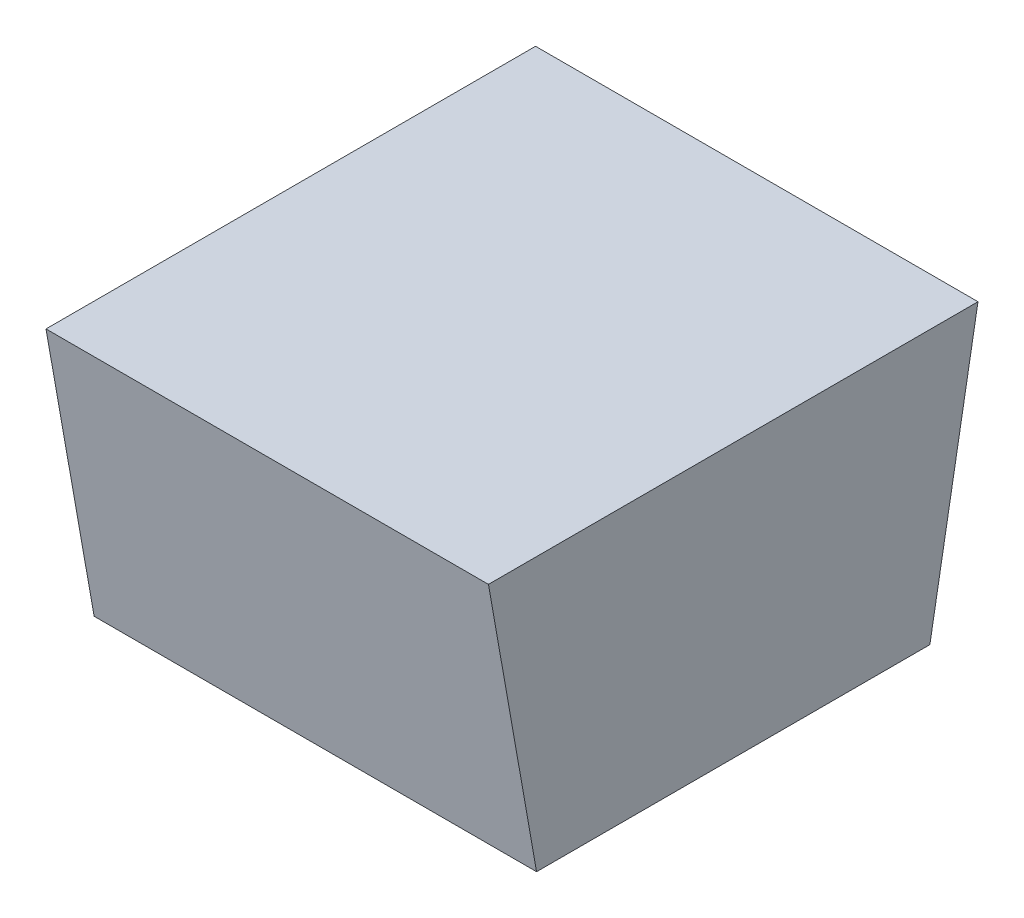
from build123d import *

# Parameters (mm, degrees)
SKETCH_TL_CUTTING_R    = 0.997000038
TL_CUTTING_DEPTH       = 29.999999944
SKETCH_TDF_CUTTING_W   = 2.014000036
SKETCH_TDF_CUTTING_H   = 2.014000036
TDF_CUTTING_DEPTH      = 31.033115303
VW_VR_GRINDING_DEPTH   = 1.007000018
VW_VR_GRINDING_2_DEPTH = 1.007000018
ISA_GRINDING_DEPTH     = 1.007000018
SKETCH_PRE_FRX_BRX_W   = 0.762
SKETCH_PRE_FRX_BRX_H   = 0.990000052
SKETCH_PRE_FRX_BRX_W_2 = 0.79199994
PRE_FRX_BRX_DEPTH      = 1.007000018
FA_BA_GRINDING_DEPTH   = 1.007000018


with BuildPart() as part:
    # sketch_TL_cutting → TL_cutting (new body)
    with BuildSketch(Plane(origin=(0, 0, 0), x_dir=(1, 0, 0), z_dir=(0, 1, 0))):
        with Locations(Location((0, 0, 0), (0, 0, 270))):
            Circle(SKETCH_TL_CUTTING_R)
    extrude(amount=TL_CUTTING_DEPTH)

    # sketch_TDF_cutting → TDF_cutting (cut, through all)
    with BuildSketch(Plane(origin=(0, 0, 0), x_dir=(1, 0, 0), z_dir=(0, 1, 0))):
        with Locations((-1.610000082, 0)):
            Rectangle(SKETCH_TDF_CUTTING_W, SKETCH_TDF_CUTTING_H)
    extrude(amount=TDF_CUTTING_DEPTH, mode=Mode.SUBTRACT)


with BuildPart() as body_2:
    # sketch_VW_VR_grinding → VW_VR_grinding (new, symmetric)
    with BuildSketch(Plane(origin=(0, 0, 0), x_dir=(0, 0, -1), z_dir=(1, 0, 0))):
        with BuildLine():
            Line((-0.992000048, -0.00999998), (-0.992000048, 0.978888966))
            ThreePointArc((-0.992000048, 0.978888966), (-0.992048375, 0.979995844), (-0.99219299, 0.981094298))
            Line((-0.99219299, 0.981094298), (-1.016999998, 1.121781834))
            Line((-1.016999998, 1.121781834), (-1.007000018, -0.00999998))
            Line((-1.007000018, -0.00999998), (-0.992000048, -0.00999998))
        make_face()
    extrude(amount=VW_VR_GRINDING_DEPTH, both=True)


with BuildPart() as body_3:
    # sketch_VW_VR_grinding → VW_VR_grinding 2 (new, symmetric)
    with BuildSketch(Plane(origin=(0, 0, 0), x_dir=(0, 0, -1), z_dir=(1, 0, 0))):
        with BuildLine():
            Line((0.992000048, -0.00999998), (0.992000048, 0.978888966))
            ThreePointArc((0.992000048, 0.978888966), (0.992048375, 0.979995844), (0.99219299, 0.981094298))
            Line((0.99219299, 0.981094298), (1.016999998, 1.121781834))
            Line((1.016999998, 1.121781834), (1.007000018, -0.00999998))
            Line((1.007000018, -0.00999998), (0.992000048, -0.00999998))
        make_face()
    extrude(amount=VW_VR_GRINDING_2_DEPTH, both=True)


    add(body_2.part)  # ISA_grinding merges body 2
    # sketch_ISA_grinding → ISA_grinding (add, symmetric)
    with BuildSketch(Plane(origin=(0, 0, 0), x_dir=(0, 0, -1), z_dir=(1, 0, 0))):
        Polygon((-0.199999981, 0), (0.199999981, 0), (1.007000018, 4.576724638), (1.007000018, -0.02999994), (-1.007000018, -0.02999994), (-1.007000018, 4.576724638), align=None)
    extrude(amount=ISA_GRINDING_DEPTH, both=True)

    # sketch_pre_FRX_BRX → pre_FRX_BRX (add, symmetric)
    with BuildSketch(Plane.XY):
        with Locations((0.616000038, 0.485000046)):
            Rectangle(SKETCH_PRE_FRX_BRX_W, SKETCH_PRE_FRX_BRX_H)
        with Locations((-0.621000028, 0.485000046)):
            Rectangle(SKETCH_PRE_FRX_BRX_W_2, SKETCH_PRE_FRX_BRX_H)
    extrude(amount=PRE_FRX_BRX_DEPTH, both=True)

    # sketch_FA_BA_grinding → FA_BA_grinding (add, symmetric)
    with BuildSketch(Plane.XY):
        Polygon((0.225000058, -0.00999998), (0.225000058, 0.990000052), (1.124000038, 11.265616844), (1.124000038, -0.00999998), align=None)
        Polygon((-0.225000058, -0.00999998), (-0.225000058, 0.990000052), (-0.730000064, 6.762176533), (-0.730000064, -0.00999998), align=None)
    extrude(amount=FA_BA_GRINDING_DEPTH, both=True)


with BuildPart() as part_1:
    add(part.part)

    # B1_fix: cut body 3
    add(body_3.part, mode=Mode.SUBTRACT)

    # SurfaceCut1
    split(bisect_by=Plane(origin=(0, 0.277595628, 0), x_dir=(1, 0, 0), z_dir=(0, 1, 0)), keep=Keep.BOTTOM)


solid = part_1.part
